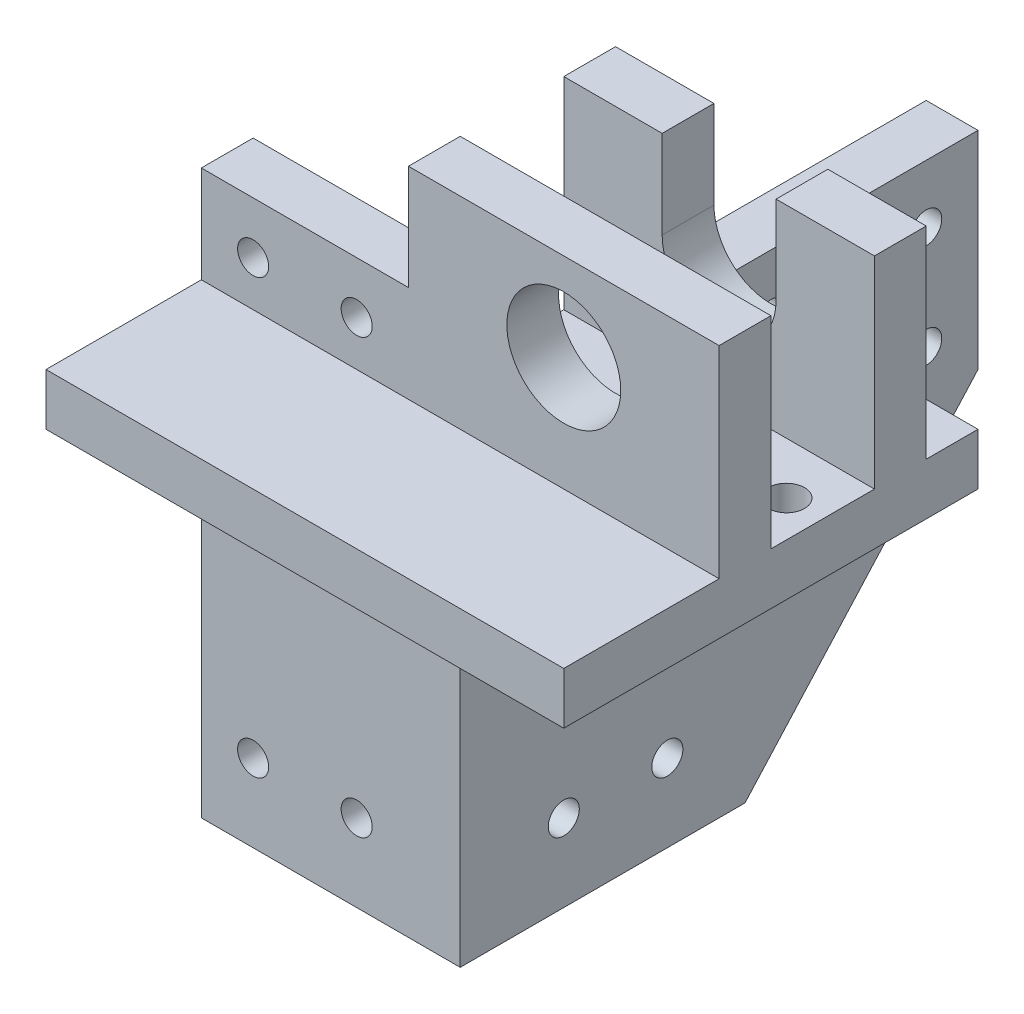
from build123d import *

# Parameters (mm, degrees)
BOSS_EXTRUDE1_DEPTH = 10
SKETCH2_W           = 40
SKETCH2_H           = 10
BOSS_EXTRUDE2_DEPTH = 18.71
BOSS_EXTRUDE3_DEPTH = 80
SKETCH5_W           = 10
SKETCH5_H           = 90
BOSS_EXTRUDE4_DEPTH = 50
CUT_EXTRUDE1_DEPTH  = 10
SKETCH7_W           = 60
SKETCH7_H           = 10
BOSS_EXTRUDE5_DEPTH = 39
SKETCH8_R           = 3.5
CUT_EXTRUDE2_DEPTH  = 10
CUT_EXTRUDE3_DEPTH  = 10
SKETCH10_R          = 11
SKETCH10_R_2        = 3
CUT_EXTRUDE4_DEPTH  = 10
SKETCH11_R          = 3
CUT_EXTRUDE5_DEPTH  = 10
CUT_EXTRUDE6_START  = -10
CUT_EXTRUDE6_DEPTH  = 10


with BuildPart() as part:
    # Sketch1 → Boss-Extrude1 (new body)
    with BuildSketch(Plane(origin=(0, 0, 0), x_dir=(1, 0, 0), z_dir=(0, 1, 0))):
        Polygon((0, 0), (100, 0), (100, 80), (40, 80), (40, 40), (0, 40), align=None)
    extrude(amount=BOSS_EXTRUDE1_DEPTH)

    # Sketch2 → Boss-Extrude2 (add)
    with BuildSketch(Plane(origin=(0, 10, 0), x_dir=(1, 0, 0), z_dir=(0, 1, 0))):
        with Locations((20, 35)):
            Rectangle(SKETCH2_W, SKETCH2_H)
    extrude(amount=BOSS_EXTRUDE2_DEPTH)

    # Sketch3 → Boss-Extrude3 (add)
    with BuildSketch(Plane.XZ):
        Polygon((0, -30), (50, -30), (50, -80), (40, -80), (40, -40), (0, -40), align=None)
    extrude(amount=BOSS_EXTRUDE3_DEPTH)

    # Sketch5 → Boss-Extrude4 (add)
    with BuildSketch(Plane(origin=(0, 0, -80), x_dir=(-1, 0, 0), z_dir=(0, 0, -1))):
        with Locations((-45, -35)):
            Rectangle(SKETCH5_W, SKETCH5_H)
    extrude(amount=BOSS_EXTRUDE4_DEPTH)

    # Sketch6 → Cut-Extrude1 (cut)
    with BuildSketch(Plane.ZY.offset(-40)):
        Polygon((-85, -80), (-130, -30), (-130, -80), align=None)
    extrude(amount=-CUT_EXTRUDE1_DEPTH, mode=Mode.SUBTRACT)

    # Sketch7 → Boss-Extrude5 (add)
    with BuildSketch(Plane(origin=(0, 10, 0), x_dir=(1, 0, 0), z_dir=(0, 1, 0))):
        with Locations((70, 65)):
            Rectangle(SKETCH7_W, SKETCH7_H)
        with Locations((70, 35)):
            Rectangle(SKETCH7_W, SKETCH7_H)
    extrude(amount=BOSS_EXTRUDE5_DEPTH)

    # Sketch8 → Cut-Extrude2 (cut)
    with BuildSketch(Plane(origin=(0, 10, 0), x_dir=(1, 0, 0), z_dir=(0, 1, 0))):
        with Locations(Location((47, 50, 0), (0, 0, 270))):
            Circle(SKETCH8_R)
        with Locations(Location((93, 50, 0), (0, 0, 270))):
            Circle(SKETCH8_R)
    extrude(amount=-CUT_EXTRUDE2_DEPTH, mode=Mode.SUBTRACT)

    # Sketch9 → Cut-Extrude3 (cut)
    with BuildSketch(Plane(origin=(50, 0, 0), x_dir=(0, 0, -1), z_dir=(1, 0, 0))):
        Polygon((50, 0), (57, 0), (57, -6), (43, -6), (43, 0), align=None)
    extrude(amount=-CUT_EXTRUDE3_DEPTH, mode=Mode.SUBTRACT)

    # Sketch10 → Cut-Extrude4 (cut)
    with BuildSketch(Plane.XY.offset(-30)):
        with Locations((70, 32)):
            Circle(SKETCH10_R)
        with Locations((30, 18.71)):
            Circle(SKETCH10_R_2)
        with Locations((10, 18.71)):
            Circle(SKETCH10_R_2)
        with Locations((30, -15)):
            Circle(SKETCH10_R_2)
        with Locations((10, -15)):
            Circle(SKETCH10_R_2)
        with Locations((30, -65)):
            Circle(SKETCH10_R_2)
        with Locations((10, -65)):
            Circle(SKETCH10_R_2)
    extrude(amount=-CUT_EXTRUDE4_DEPTH, mode=Mode.SUBTRACT)

    # Sketch11 → Cut-Extrude5 (cut)
    with BuildSketch(Plane(origin=(50, 0, 0), x_dir=(0, 0, -1), z_dir=(1, 0, 0))):
        with Locations((50, -15)):
            Circle(SKETCH11_R)
        with Locations((70, -15)):
            Circle(SKETCH11_R)
        with Locations((70, -65)):
            Circle(SKETCH11_R)
        with Locations((50, -65)):
            Circle(SKETCH11_R)
        with Locations((90, -1.3)):
            Circle(SKETCH11_R)
        with Locations((120, -1.3)):
            Circle(SKETCH11_R)
        with Locations((90, -21.3)):
            Circle(SKETCH11_R)
        with Locations((120, -21.3)):
            Circle(SKETCH11_R)
    extrude(amount=-CUT_EXTRUDE5_DEPTH, mode=Mode.SUBTRACT)

    # Sketch12 → Cut-Extrude6 (cut)
    with BuildSketch(Plane(origin=(0, 0, -70), x_dir=(-1, 0, 0), z_dir=(0, 0, -1)).offset(CUT_EXTRUDE6_START)):
        with BuildLine():
            Line((-70, 49), (-59, 49))
            Line((-59, 49), (-59, 32))
            ThreePointArc((-59, 32), (-70, 21), (-81, 32))
            Line((-81, 32), (-81, 49))
            Line((-81, 49), (-70, 49))
        make_face()
    extrude(amount=CUT_EXTRUDE6_DEPTH, mode=Mode.SUBTRACT)


solid = part.part
